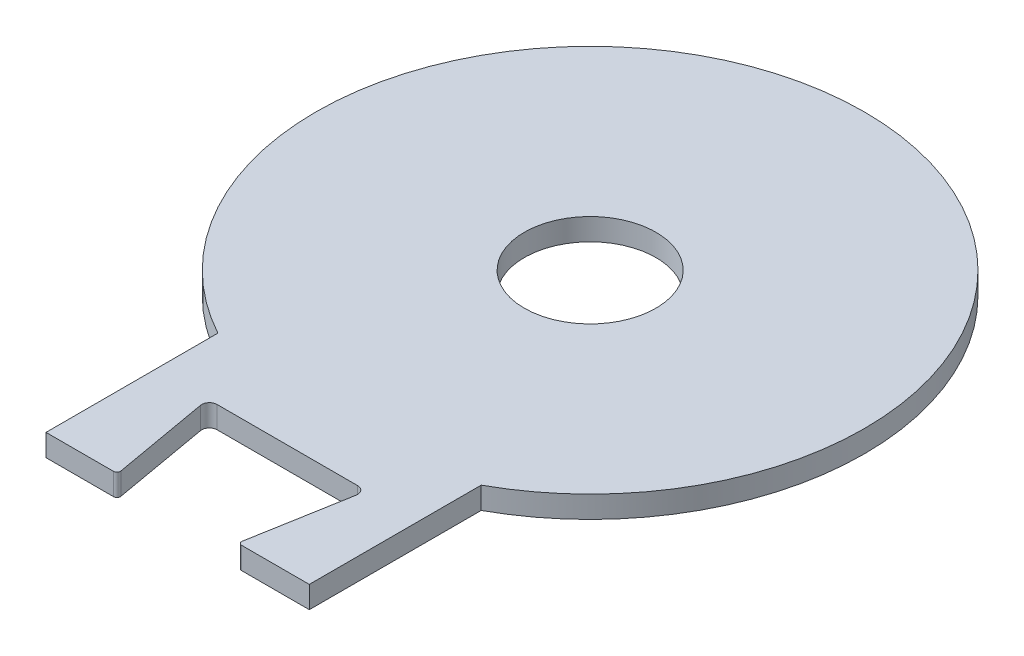
from build123d import *

# Parameters (mm, degrees)
SKETCH1_R           = 3
BOSS_EXTRUDE1_DEPTH = 1
SKETCH2_R           = 12.5
SKETCH2_R_2         = 3
BOSS_EXTRUDE2_DEPTH = 1
SKETCH4_W           = 12
SKETCH4_H           = 0.2
CUT_EXTRUDE1_DEPTH  = 4
FILLET3_R           = 0.35
FILLET4_R           = 0.15


with BuildPart() as part:
    # Sketch1 → Boss-Extrude1 (new body)
    with BuildSketch(Plane(origin=(0, 0, 0), x_dir=(1, 0, 0), z_dir=(0, 1, 0))):
        Polygon((-6, 6), (-6, -13.291502622), (-6, -19), (-2.70227506, -19), (-3.619175359, -13.8), (0, -13.8), (3.619175359, -13.8), (2.70227506, -19), (6, -19), (6, -13.291502622), (6, 6), align=None)
        with Locations(Location((0, 0, 0), (0, 0, 270))):
            Circle(SKETCH1_R, mode=Mode.SUBTRACT)
    extrude(amount=BOSS_EXTRUDE1_DEPTH)

    # Sketch2 → Boss-Extrude2 (add)
    with BuildSketch(Plane(origin=(0, 0, 0), x_dir=(1, 0, 0), z_dir=(0, 1, 0))):
        Circle(SKETCH2_R)
        with Locations(Location((0, 0, 0), (0, 0, 270))):
            Circle(SKETCH2_R_2, mode=Mode.SUBTRACT)
    extrude(amount=BOSS_EXTRUDE2_DEPTH)

    # Sketch4 → Cut-Extrude1 (cut)
    with BuildSketch(Plane(origin=(0, 1, 0), x_dir=(1, 0, 0), z_dir=(0, 1, 0))):
        with Locations((0, -18.9)):
            Rectangle(SKETCH4_W, SKETCH4_H)
    extrude(amount=-CUT_EXTRUDE1_DEPTH, mode=Mode.SUBTRACT)

    # Fillet3
    fillet3_edges = [part.edges().sort_by_distance(p)[0] for p in [
        (3.619175359, 0.5, 13.8),
        (-3.619175359, 0.5, 13.8),
    ]]
    fillet(fillet3_edges, radius=FILLET3_R)

    # Fillet4
    fillet4_edges = [part.edges().sort_by_distance(p)[0] for p in [
        (2.737540456, 0.5, 18.8),
        (-2.737540456, 0.5, 18.8),
    ]]
    fillet(fillet4_edges, radius=FILLET4_R)


solid = part.part
